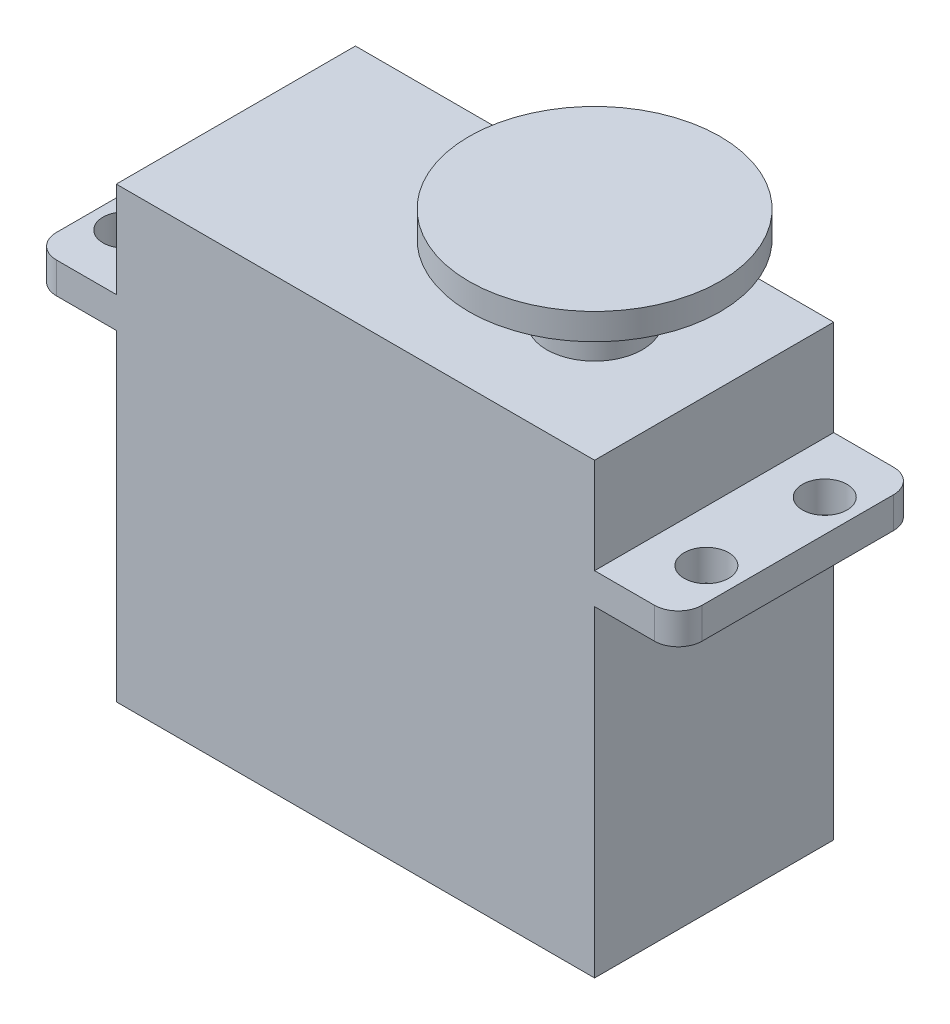
from build123d import *

# Parameters (mm, degrees)
SKETCH_1_W      = 40
SKETCH_1_H      = 20
EXTRUDE_1_DEPTH = 26.9
SKETCH_2_R      = 1.863789346
EXTRUDE_2_DEPTH = 2.6
SKETCH_3_W      = 40
SKETCH_3_H      = 20
EXTRUDE_3_DEPTH = 8
SKETCH_4_R      = 4
EXTRUDE_4_DEPTH = 6
SKETCH_5_R      = 10.5
EXTRUDE_5_DEPTH = 2.2


with BuildPart() as part:
    # 草图1 → 凸台-拉伸1 (new body)
    with BuildSketch(Plane(origin=(0, 0, 0), x_dir=(1, 0, 0), z_dir=(0, 1, 0))):
        with Locations((-10, 0)):
            Rectangle(SKETCH_1_W, SKETCH_1_H)
    extrude(amount=-EXTRUDE_1_DEPTH)

    # 草图2 → 凸台-拉伸2 (add)
    with BuildSketch(Plane(origin=(0, 0, 0), x_dir=(1, 0, 0), z_dir=(0, 1, 0))):
        with BuildLine():
            Line((-35, -10), (15, -10))
            ThreePointArc((15, -10), (16.414213562, -9.414213562), (17, -8))
            Line((17, -8), (17, 8))
            ThreePointArc((17, 8), (16.414213562, 9.414213562), (15, 10))
            Line((15, 10), (-35, 10))
            ThreePointArc((-35, 10), (-36.414213562, 9.414213562), (-37, 8))
            Line((-37, 8), (-37, -8))
            ThreePointArc((-37, -8), (-36.414213562, -9.414213562), (-35, -10))
        make_face()
        with Locations(Location((-34.3, -4.95, 0), (0, 0, 270))):
            Circle(SKETCH_2_R, mode=Mode.SUBTRACT)
        with Locations(Location((-34.3, 4.95, 0), (0, 0, 270))):
            Circle(SKETCH_2_R, mode=Mode.SUBTRACT)
        with Locations(Location((14.3, -4.95, 0), (0, 0, 270))):
            Circle(SKETCH_2_R, mode=Mode.SUBTRACT)
        with Locations(Location((14.3, 4.95, 0), (0, 0, 270))):
            Circle(SKETCH_2_R, mode=Mode.SUBTRACT)
    extrude(amount=EXTRUDE_2_DEPTH)

    # 草图3 → 凸台-拉伸3 (add)
    with BuildSketch(Plane(origin=(0, 2.6, 0), x_dir=(1, 0, 0), z_dir=(0, 1, 0))):
        with Locations((-10, 0)):
            Rectangle(SKETCH_3_W, SKETCH_3_H)
    extrude(amount=EXTRUDE_3_DEPTH)

    # 草图4 → 凸台-拉伸4 (add)
    with BuildSketch(Plane(origin=(0, 10.6, 0), x_dir=(1, 0, 0), z_dir=(0, 1, 0))):
        with Locations(Location((0, 0, 0), (0, 0, 270))):
            Circle(SKETCH_4_R)
    extrude(amount=EXTRUDE_4_DEPTH)

    # 草图5 → 凸台-拉伸5 (add)
    with BuildSketch(Plane(origin=(0, 16.6, 0), x_dir=(1, 0, 0), z_dir=(0, 1, 0))):
        with Locations(Location((0, 0, 0), (0, 0, 270))):
            Circle(SKETCH_5_R)
    extrude(amount=EXTRUDE_5_DEPTH)


solid = part.part
